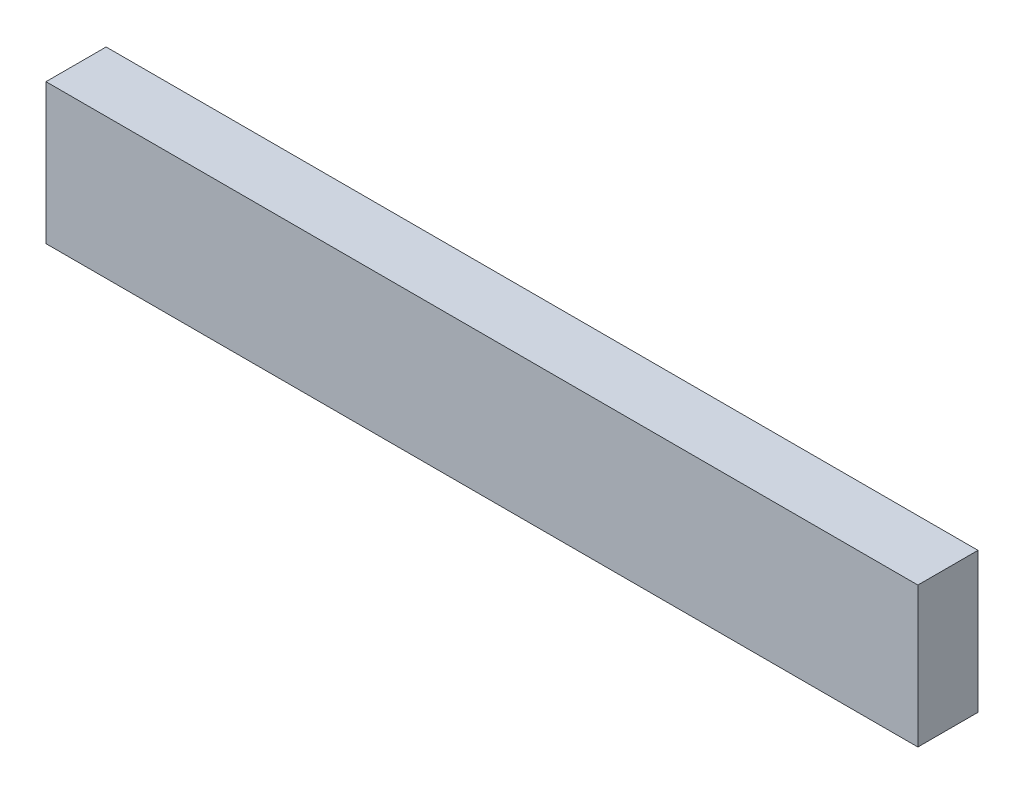
from build123d import *

# Parameters (mm, degrees)
SKETCH1_W           = 38.1
SKETCH1_H           = 88.9
BOSS_EXTRUDE1_DEPTH = 552.45


with BuildPart() as part:
    # Sketch1 → Boss-Extrude1 (new body)
    with BuildSketch(Plane(origin=(0, 0, 0), x_dir=(0, 0, -1), z_dir=(1, 0, 0))):
        with Locations((19.05, 44.45)):
            Rectangle(SKETCH1_W, SKETCH1_H)
    extrude(amount=BOSS_EXTRUDE1_DEPTH)


solid = part.part
